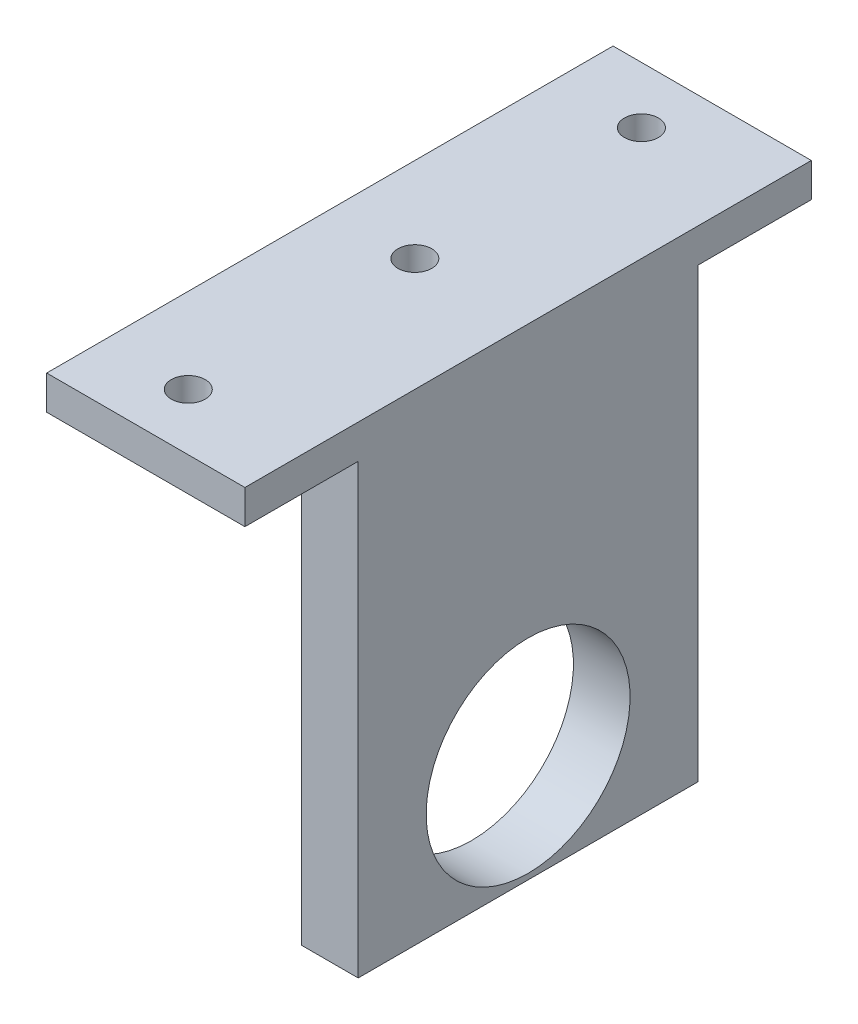
from build123d import *

# Parameters (mm, degrees)
SKETCH_1_W          = 30
SKETCH_1_H          = 39.5
EXTRUDE_1_DEPTH     = 5
SKETCH_2_R          = 9
CUT_EXTRUDE_1_DEPTH = 5
SKETCH_3_W          = 17.5
SKETCH_3_H          = 50
EXTRUDE_2_DEPTH     = 3
SKETCH_6_R          = 1.5
CUT_EXTRUDE_2_DEPTH = 3


with BuildPart() as part:
    # 草图1 → 凸台-拉伸1 (new body)
    with BuildSketch(Plane(origin=(0, 0, 0), x_dir=(0, 0, -1), z_dir=(1, 0, 0))):
        with Locations((0, -8.75)):
            Rectangle(SKETCH_1_W, SKETCH_1_H)
    extrude(amount=EXTRUDE_1_DEPTH)

    # 草图2 → 切除-拉伸1 (cut)
    with BuildSketch(Plane(origin=(5, 0, 0), x_dir=(0, 0, -1), z_dir=(1, 0, 0))):
        with Locations(Location((0, -19, 0), (0, 0, 90))):
            Circle(SKETCH_2_R)
    extrude(amount=-CUT_EXTRUDE_1_DEPTH, mode=Mode.SUBTRACT)

    # 草图3 → 凸台-拉伸2 (add)
    with BuildSketch(Plane(origin=(0, 11, 0), x_dir=(1, 0, 0), z_dir=(0, 1, 0))):
        with Locations((-3.75, 0)):
            Rectangle(SKETCH_3_W, SKETCH_3_H)
    extrude(amount=EXTRUDE_2_DEPTH)

    # 草图6 → 切除-拉伸2 (cut)
    with BuildSketch(Plane(origin=(0, 14, 0), x_dir=(1, 0, 0), z_dir=(0, 1, 0))):
        with Locations(Location((-5, 0, 0), (0, 0, 270))):
            Circle(SKETCH_6_R)
        with Locations(Location((-5, 20, 0), (0, 0, 270))):
            Circle(SKETCH_6_R)
        with Locations(Location((-5, -20, 0), (0, 0, 270))):
            Circle(SKETCH_6_R)
    extrude(amount=-CUT_EXTRUDE_2_DEPTH, mode=Mode.SUBTRACT)


solid = part.part
